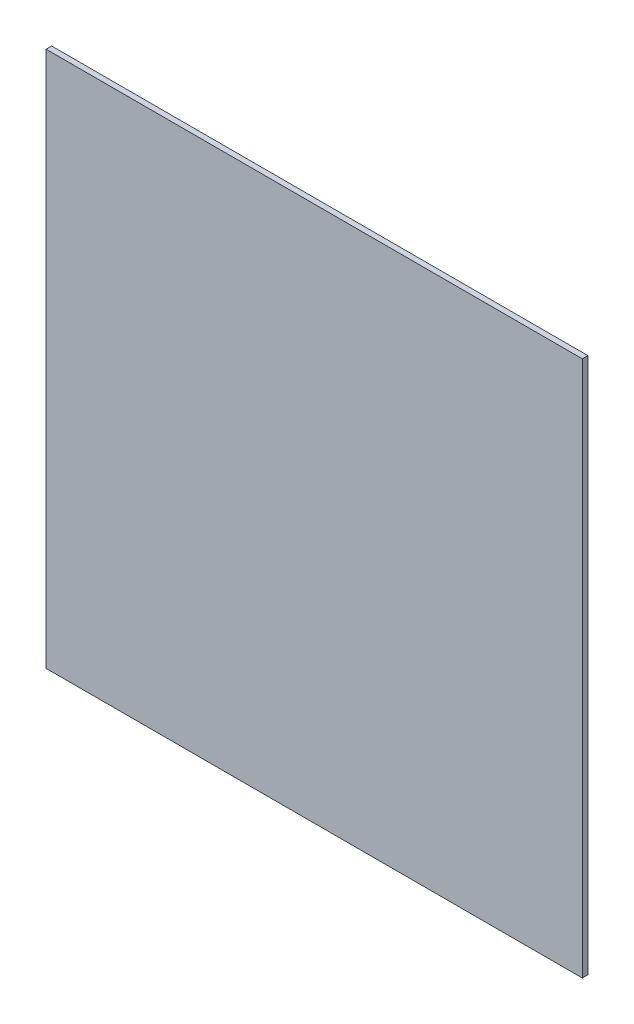
from build123d import *

# Parameters (mm, degrees)
SKETCH1_W           = 2400
SKETCH1_H           = 2400
BOSS_EXTRUDE1_DEPTH = 25


with BuildPart() as part:
    # Sketch1 → Boss-Extrude1 (new body)
    with BuildSketch(Plane.XY):
        Rectangle(SKETCH1_W, SKETCH1_H)
    extrude(amount=BOSS_EXTRUDE1_DEPTH)


solid = part.part
